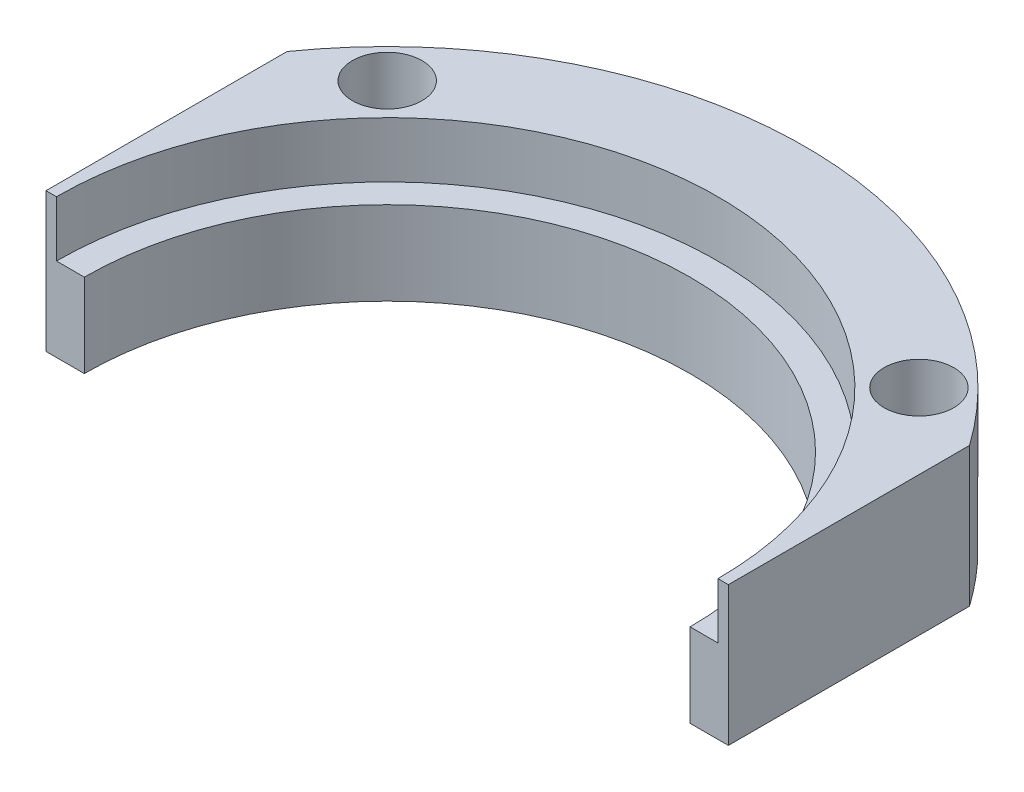
from build123d import *

# Parameters (mm, degrees)
BOSS_EXTRUDE1_DEPTH = 20
SKETCH2_R           = 43.5
CUT_EXTRUDE2_DEPTH  = 81.006249756
SKETCH3_R           = 47.5
CUT_EXTRUDE3_DEPTH  = 8
SKETCH4_R           = 6.5
CUT_EXTRUDE4_DEPTH  = 10
SKETCH4_3_R         = 5
CUT_EXTRUDE6_DEPTH  = 81.006249756


with BuildPart() as part:
    # Sketch1 → Boss-Extrude1 (new body)
    with BuildSketch(Plane(origin=(0, 0, 0), x_dir=(1, 0, 0), z_dir=(0, 1, 0))):
        with BuildLine():
            Line((-49, 34.626579386), (-49, 0))
            Line((-49, 0), (49, 0))
            Line((49, 0), (49, 34.626579386))
            ThreePointArc((49, 34.626579386), (0, 60), (-49, 34.626579386))
        make_face()
    extrude(amount=BOSS_EXTRUDE1_DEPTH)

    # Sketch2 → Cut-Extrude2 (cut, through all)
    with BuildSketch(Plane.XZ):
        Circle(SKETCH2_R)
    extrude(amount=-CUT_EXTRUDE2_DEPTH, mode=Mode.SUBTRACT)

    # Sketch3 → Cut-Extrude3 (cut)
    with BuildSketch(Plane(origin=(0, 20, 0), x_dir=(1, 0, 0), z_dir=(0, 1, 0))):
        Circle(SKETCH3_R)
    extrude(amount=-CUT_EXTRUDE3_DEPTH, mode=Mode.SUBTRACT)

    # Sketch4 → Cut-Extrude4 (cut)
    with BuildSketch(Plane.XZ):
        with Locations((-38.183766184, 38.183766184)):
            Circle(SKETCH4_R)
        with Locations((38.183766184, 38.183766184)):
            Circle(SKETCH4_R)
        with Locations((38.183766184, -38.183766184)):
            Circle(SKETCH4_R)
        with Locations((-38.183766184, -38.183766184)):
            Circle(SKETCH4_R)
    extrude(amount=-CUT_EXTRUDE4_DEPTH, mode=Mode.SUBTRACT)

    # Sketch4<3> → Cut-Extrude6 (cut, through all)
    with BuildSketch(Plane.XZ):
        with Locations((-38.183766184, 38.183766184)):
            Circle(SKETCH4_3_R)
        with Locations((38.183766184, 38.183766184)):
            Circle(SKETCH4_3_R)
        with Locations((38.183766184, -38.183766184)):
            Circle(SKETCH4_3_R)
        with Locations((-38.183766184, -38.183766184)):
            Circle(SKETCH4_3_R)
    extrude(amount=-CUT_EXTRUDE6_DEPTH, mode=Mode.SUBTRACT)


solid = part.part
